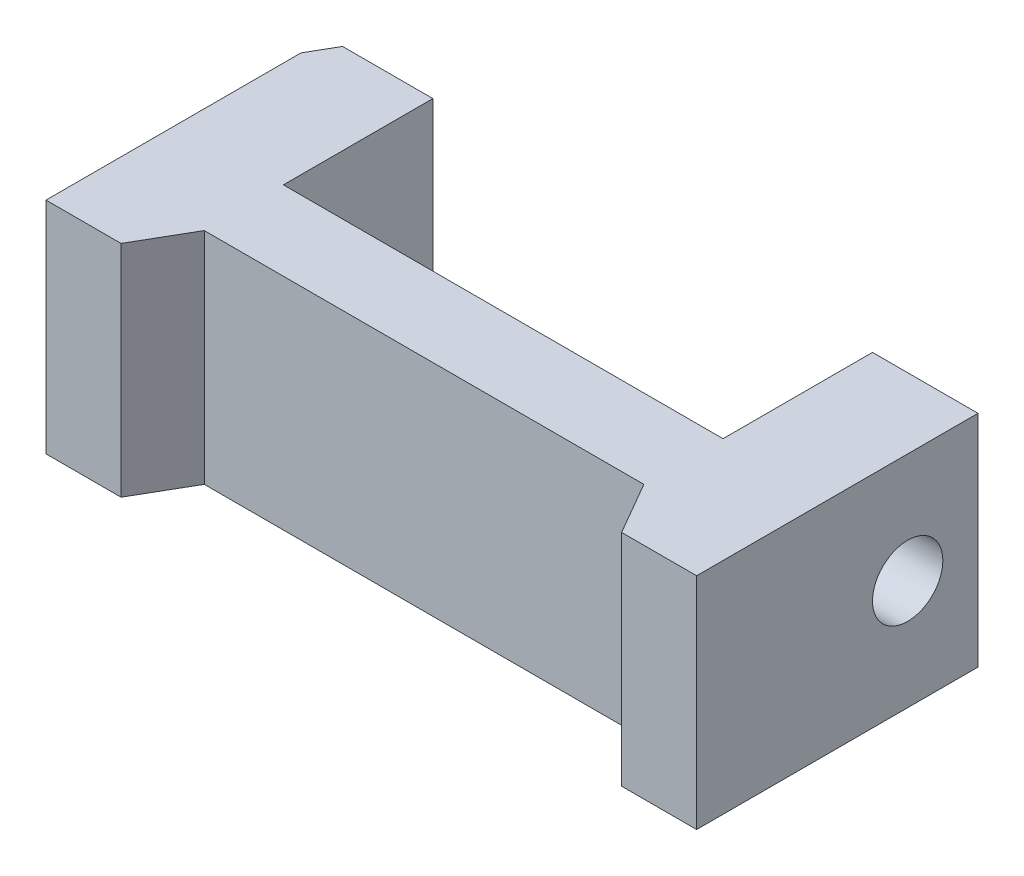
from build123d import *

# Parameters (mm, degrees)
BOSS_EXTRUDE1_DEPTH       = 25
F_8_0MM_DOWEL_HOLE2_D     = 8
F_8_0MM_DOWEL_HOLE2_DEPTH = 12


with BuildPart() as part:
    # Sketch1 → Boss-Extrude1 (new body)
    with BuildSketch(Plane(origin=(0, 0, 0), x_dir=(1, 0, 0), z_dir=(0, 1, 0))):
        Polygon((-34.995258132, 4), (-34.995258132, 33), (-33.263207324, 36), (-22.995258132, 36), (-22.995258132, 19), (27.004741868, 19), (27.004741868, 36), (39.004741868, 36), (39.004741868, 4), (30.468843483, 4), (27.004741868, 10), (-22.995258132, 10), (-26.459359747, 4), align=None)
    extrude(amount=BOSS_EXTRUDE1_DEPTH)

    # Ø8.0mm Dowel Hole2
    with Locations(Plane(origin=(39.004741868, 0, 0), x_dir=(0, 0, -1), z_dir=(1, 0, 0))):
        with Locations((28, 12.5)):
            Hole(F_8_0MM_DOWEL_HOLE2_D / 2, depth=F_8_0MM_DOWEL_HOLE2_DEPTH)


solid = part.part
